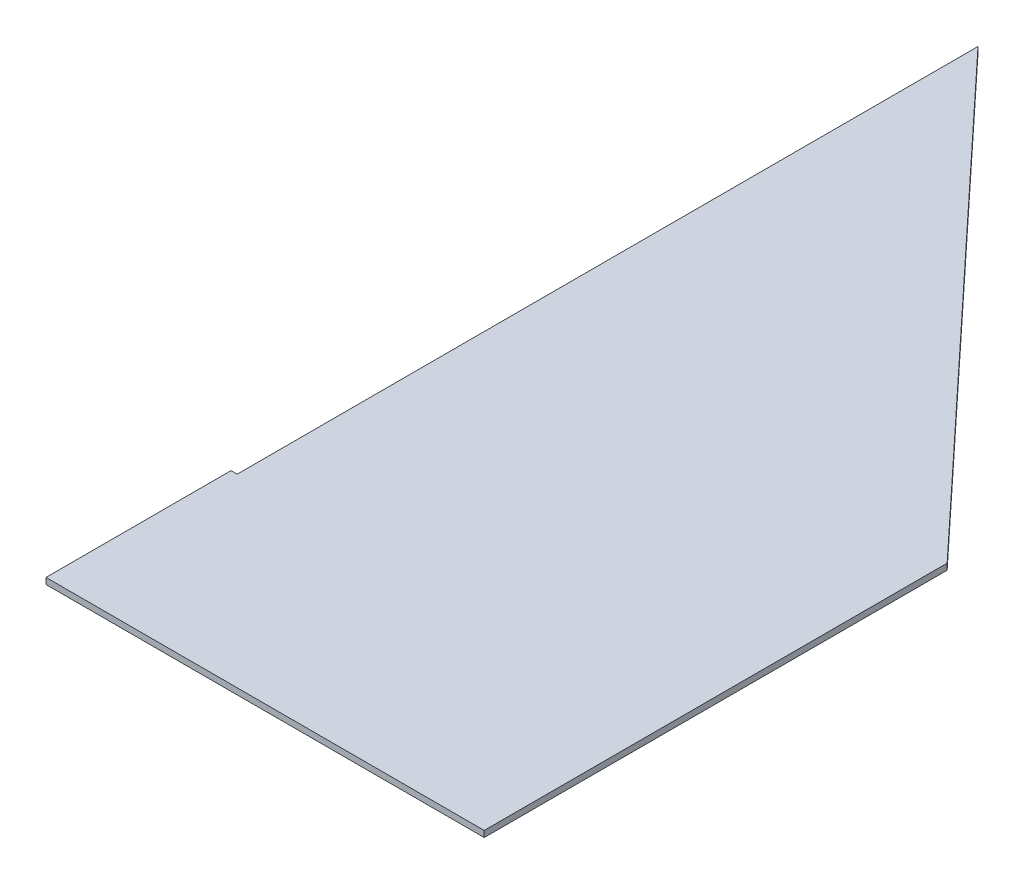
from build123d import *

# Parameters (mm, degrees)
ESTRUSIONE_ESTRUSIONE1_DEPTH = 2


with BuildPart() as part:
    # Forma aletta → Estrusione-Estrusione1 (new body)
    with BuildSketch(Plane(origin=(0, 0, 0), x_dir=(1, 0, 0), z_dir=(0, 1, 0))):
        Polygon((0, 300), (0, 59.93), (-2, 59.93), (-2, 0), (0, 0), (140, 0), (140, 150), align=None)
    extrude(amount=ESTRUSIONE_ESTRUSIONE1_DEPTH)


solid = part.part
